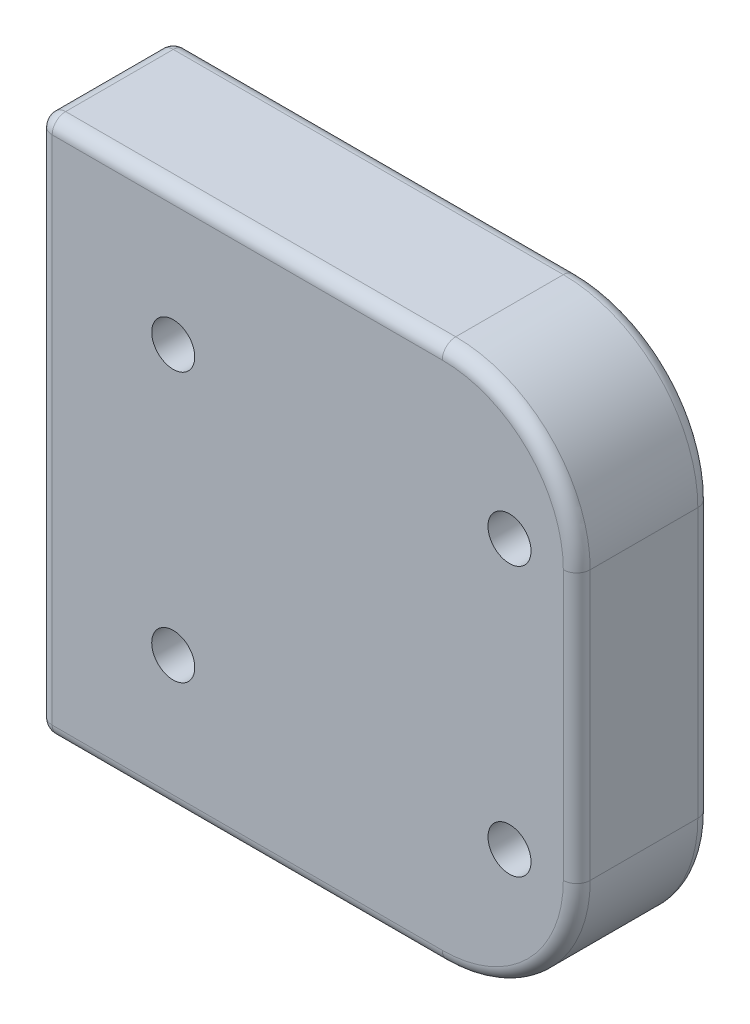
from build123d import *

# Parameters (mm, degrees)
SKETCH_1_W          = 40
SKETCH_1_H          = 40
EXTRUDE_1_DEPTH     = 10
SKETCH_2_R          = 1.6
CUT_EXTRUDE_1_DEPTH = 31
FILLET_1_R          = 10
FILLET_2_R          = 1


with BuildPart() as part:
    # 草图1 → 凸台-拉伸1 (new body)
    with BuildSketch(Plane.XY):
        Rectangle(SKETCH_1_W, SKETCH_1_H)
    extrude(amount=EXTRUDE_1_DEPTH)

    # 草图2 → 切除-拉伸1 (cut, through all)
    with BuildSketch(Plane.XY.offset(10)):
        with Locations((-10, 10)):
            Circle(SKETCH_2_R)
        with Locations(Location((15, 10, 0), (0, 0, 180))):
            Circle(SKETCH_2_R)
        with Locations((15, -10)):
            Circle(SKETCH_2_R)
        with Locations(Location((-10, -10, 0), (0, 0, 180))):
            Circle(SKETCH_2_R)
    extrude(amount=-CUT_EXTRUDE_1_DEPTH, mode=Mode.SUBTRACT)

    # 圆角1
    fillet_1_edges = [part.edges().sort_by_distance(p)[0] for p in [
        (20, -20, 5),
        (20, 20, 5),
    ]]
    fillet(fillet_1_edges, radius=FILLET_1_R)

    # 圆角2
    fillet_2_edges = [part.edges().sort_by_distance(p)[0] for p in [
        (-20, 0, 10),
        (-5, -20, 10),
        (20, 0, 0),
        (20, 0, 10),
        (-5, 20, 0),
        (17.071067812, 17.071067812, 0),
        (17.071067812, -17.071067812, 0),
        (-5, 20, 10),
        (17.071067812, 17.071067812, 10),
        (17.071067812, -17.071067812, 10),
        (-5, -20, 0),
        (-20, 0, 0),
        (-20, -20, 5),
        (-20, 20, 5),
    ]]
    fillet(fillet_2_edges, radius=FILLET_2_R)


solid = part.part
